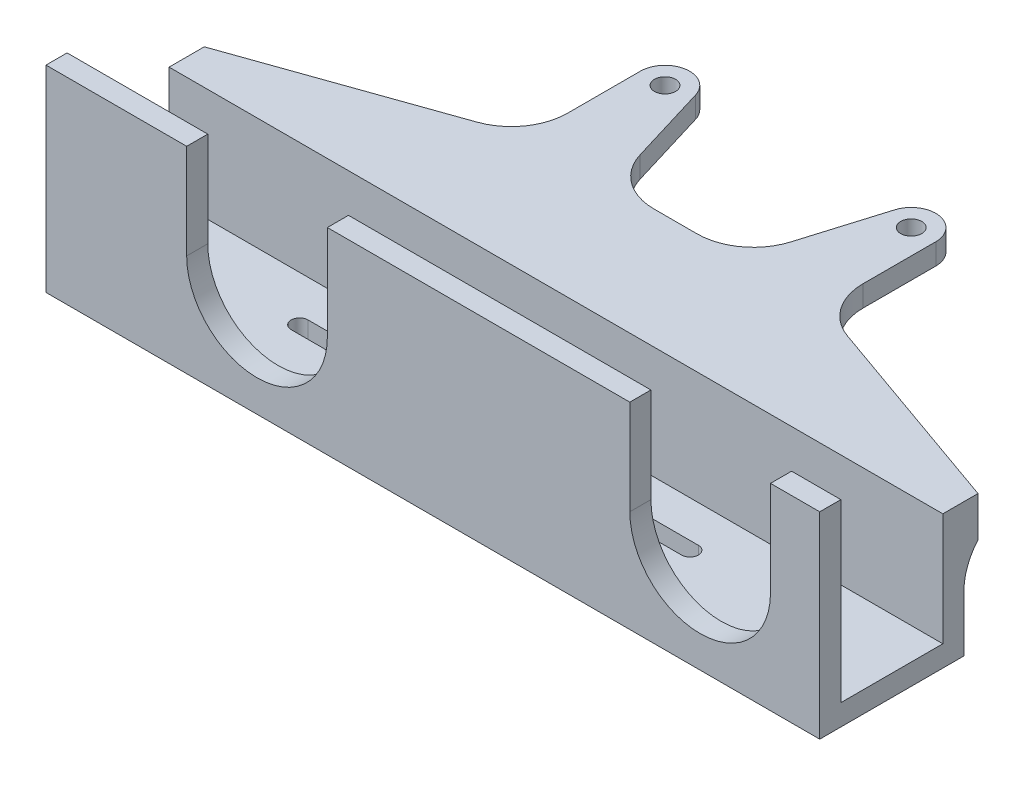
from build123d import *

# Parameters (mm, degrees)
SKETCH2_R                = 1.5
BOSS_EXTRUDE1_DEPTH      = 3
FILLET2_R                = 8
FILLET2_OF_MIRROR1_R     = 8
BOSS_EXTRUDE2_DEPTH      = 55
BOSS_EXTRUDE2_DEPTH_BACK = 55
CUT_EXTRUDE1_REACH       = 134.277
RIB1_REACH               = 202.324
SKETCH6_WALL_W           = 428.260921382
SKETCH6_WALL_H           = 5
FILLET3_R                = 8
CUT_EXTRUDE2_DEPTH       = 165.217203727


with BuildPart() as part:
    # Sketch2 → Boss-Extrude1 (new body)
    with BuildSketch(Plane(origin=(0, -88.5, 0), x_dir=(1, 0, 0), z_dir=(0, 1, 0))):
        with BuildLine():
            Line((-9, -118.2), (-14.150105789, -101.1859937))
            ThreePointArc((-14.150105789, -101.1859937), (-18.012528176, -98.73772981), (-21, -102.2))
            Line((-21, -102.2), (-21, -118.2))
            Line((-21, -118.2), (-55, -130.2))
            Line((-55, -130.2), (-55, -135.2))
            Line((-55, -135.2), (0, -135.2))
            Line((0, -135.2), (0, -118.2))
            Line((0, -118.2), (-9, -118.2))
        make_face()
        with Locations(Location((-17.5, -102.2, 0), (0, 0, 270))):
            Circle(SKETCH2_R, mode=Mode.SUBTRACT)
    boss_extrude1 = extrude(amount=-BOSS_EXTRUDE1_DEPTH)

    # Fillet2
    fillet2_edges = [part.edges().sort_by_distance(p)[0] for p in [
        (-21, -90, 118.2),
        (-9, -90, 118.2),
    ]]
    fillet(fillet2_edges, radius=FILLET2_R)

    # Mirror1: Boss-Extrude1 across plane
    add(boss_extrude1.mirror(Plane(origin=(0, 0, 0), x_dir=(0, 0, 1), z_dir=(1, 0, 0))))

    # Fillet2 of Mirror1
    fillet2_of_mirror1_edges = [part.edges().sort_by_distance(p)[0] for p in [
        (21, -90, 118.2),
        (9, -90, 118.2),
    ]]
    fillet(fillet2_of_mirror1_edges, radius=FILLET2_OF_MIRROR1_R)

    # Sketch4 → Boss-Extrude2 (add, two sides: drawn at the far end of the back side and taken through both)
    with BuildSketch(Plane(origin=(0, 0, 0), x_dir=(0, 0, -1), z_dir=(1, 0, 0)).offset(-BOSS_EXTRUDE2_DEPTH_BACK)):
        Polygon((-135.2, -91.5), (-135.2, -104.5), (-149.7, -104.5), (-149.7, -79.5), (-152.7, -79.5), (-152.7, -107.5), (-132.2, -107.5), (-132.2, -91.5), align=None)
    extrude(amount=BOSS_EXTRUDE2_DEPTH + BOSS_EXTRUDE2_DEPTH_BACK)

    # Sketch5 → Cut-Extrude1 (cut, up to next)
    with BuildSketch(Plane.XY.offset(152.7), mode=Mode.PRIVATE) as cut_extrude1_sk1:
        with BuildLine():
            Line((-35, -93), (-35, -73))
            Line((-35, -73), (-15, -73))
            Line((-15, -73), (-15, -93))
            ThreePointArc((-15, -93), (-25, -103), (-35, -93))
        make_face()
    cut_extrude1_tool1 = extrude(cut_extrude1_sk1.sketch, amount=-CUT_EXTRUDE1_REACH, mode=Mode.PRIVATE) & part.part
    # Sketch5 → Cut-Extrude1 (cut, up to next)
    with BuildSketch(Plane.XY.offset(152.7), mode=Mode.PRIVATE) as cut_extrude1_sk2:
        with BuildLine():
            Line((28, -93), (28, -73))
            Line((28, -73), (48, -73))
            Line((48, -73), (48, -93))
            ThreePointArc((48, -93), (38, -103), (28, -93))
        make_face()
    cut_extrude1_tool2 = extrude(cut_extrude1_sk2.sketch, amount=-CUT_EXTRUDE1_REACH, mode=Mode.PRIVATE) & part.part
    add(cut_extrude1_tool1.solids().sort_by_distance((-25, -87.016415, 152.7))[0], mode=Mode.SUBTRACT)
    add(cut_extrude1_tool2.solids().sort_by_distance((38, -87.016415, 152.7))[0], mode=Mode.SUBTRACT)

    # Sketch6 wall → Rib1 (add, up to next)
    with BuildSketch(Plane(origin=(-17.5, -99.5, 122.2), x_dir=(0, -0.624695047554, 0.780868809443), z_dir=(0, -0.780868809443, -0.624695047554)), mode=Mode.PRIVATE) as rib1_sk1:
        Rectangle(SKETCH6_WALL_W, SKETCH6_WALL_H)
    rib1_tool1 = extrude(rib1_sk1.sketch, amount=-RIB1_REACH, mode=Mode.PRIVATE) - part.part
    rib1 = rib1_tool1.solids().sort_by_distance((-17.5, -99.5, 122.2))[0]
    add(rib1)

    # Mirror2: Rib1 across plane
    add(rib1.mirror(Plane(origin=(0, 0, 0), x_dir=(0, 0, 1), z_dir=(1, 0, 0))))

    # Fillet3
    fillet3_edges = [part.edges().sort_by_distance(p)[0] for p in [
        (-37.5, -91.5, 132.2),
        (37.5, -91.5, 132.2),
        (0, -91.5, 132.2),
    ]]
    fillet(fillet3_edges, radius=FILLET3_R)

    # Sketch7 → Cut-Extrude2 (cut, through all)
    with BuildSketch(Plane(origin=(0, -104.5, 0), x_dir=(1, 0, 0), z_dir=(0, 1, 0))):
        with BuildLine():
            Line((-30, -140.45), (25.5, -140.45))
            ThreePointArc((25.5, -140.45), (26.7, -141.65), (25.5, -142.85))
            Line((25.5, -142.85), (-30, -142.85))
            ThreePointArc((-30, -142.85), (-31.2, -141.65), (-30, -140.45))
        make_face()
    extrude(amount=-CUT_EXTRUDE2_DEPTH, mode=Mode.SUBTRACT)


solid = part.part
